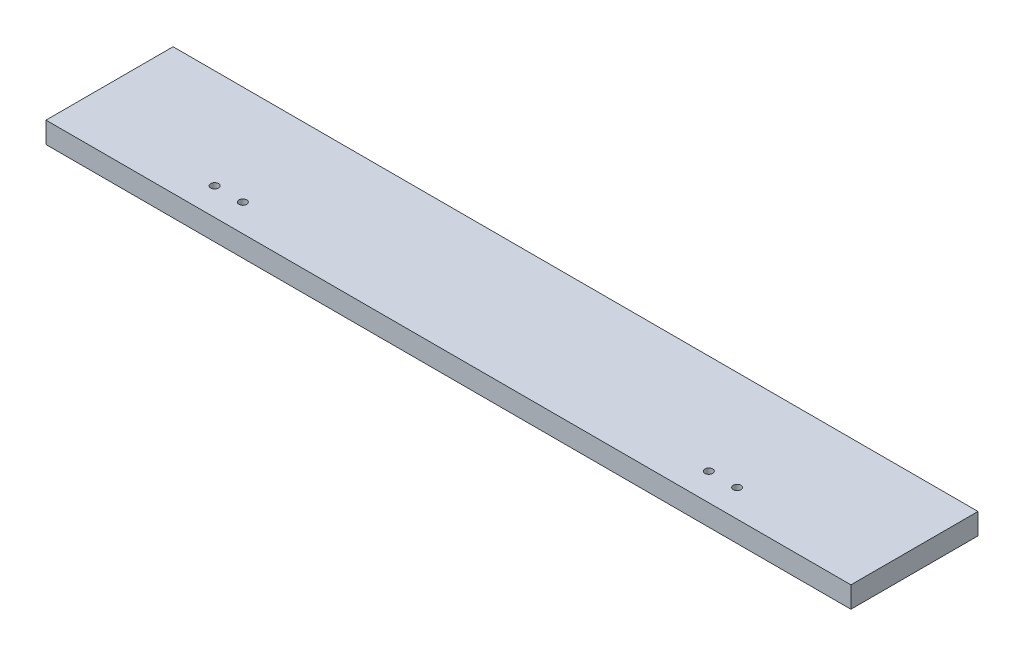
from build123d import *

# Parameters (mm, degrees)
SKETCH2_W               = 723.9
SKETCH2_H               = 114.3
BOSS_EXTRUDE3_DEPTH     = 19.05
CUT_EXTRUDE1_DEPTH      = 367.928913415
CUT_EXTRUDE1_DEPTH_BACK = 367.928913415
SKETCH3_R               = 3.4925


with BuildPart() as part:
    # Sketch2 → Boss-Extrude3 (new body)
    with BuildSketch(Plane(origin=(0, 0, 0), x_dir=(1, 0, 0), z_dir=(0, 1, 0))):
        Rectangle(SKETCH2_W, SKETCH2_H)
    extrude(amount=BOSS_EXTRUDE3_DEPTH)

    # Sketch3 → Cut-Extrude1 (cut, two sides: drawn at the far end of the back side and taken through both)
    with BuildSketch(Plane.XZ.offset(-CUT_EXTRUDE1_DEPTH_BACK)):
        with Locations(Location((-234.95, 32.512, 0), (0, 0, 270))):
            Circle(SKETCH3_R)
        with Locations(Location((-209.55, 32.512, 0), (0, 0, 270))):
            Circle(SKETCH3_R)
        with Locations(Location((209.55, 32.512, 0), (0, 0, 270))):
            Circle(SKETCH3_R)
        with Locations(Location((234.95, 32.512, 0), (0, 0, 270))):
            Circle(SKETCH3_R)
    extrude(amount=CUT_EXTRUDE1_DEPTH + CUT_EXTRUDE1_DEPTH_BACK, mode=Mode.SUBTRACT)


solid = part.part
